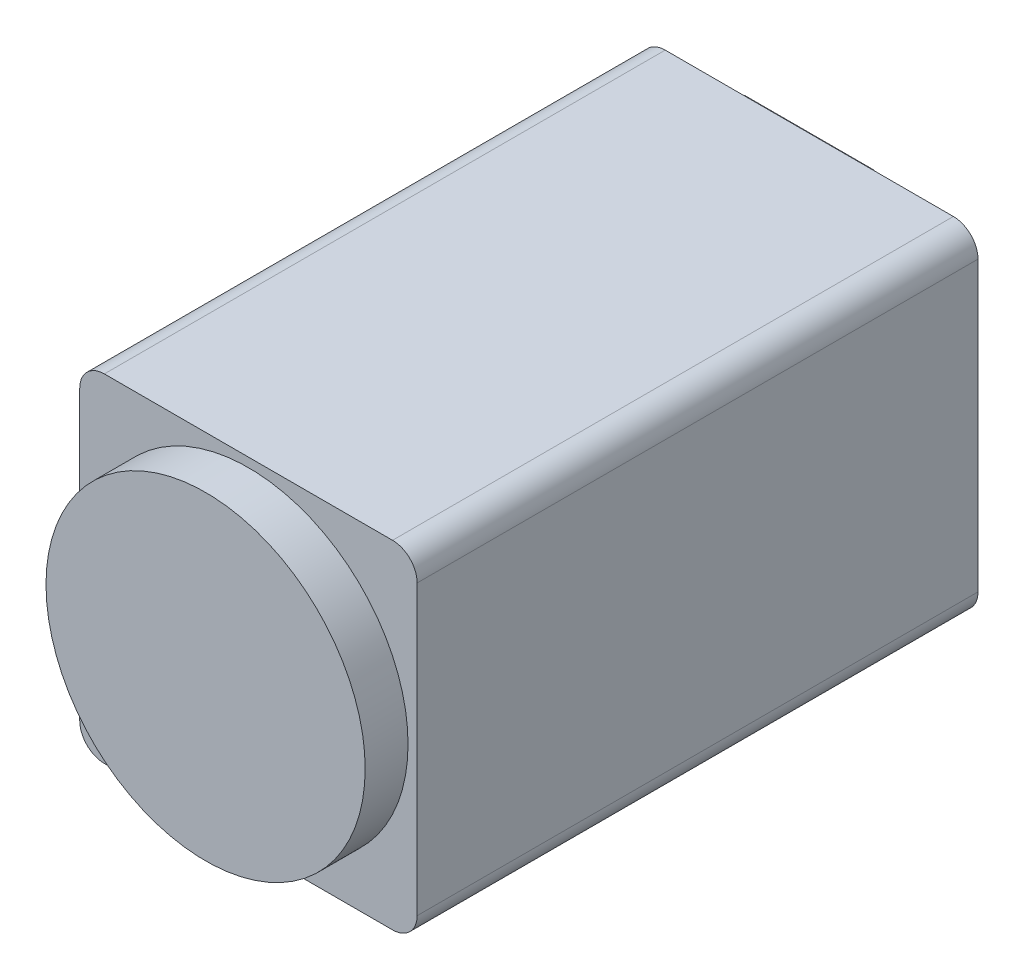
from build123d import *

# Parameters (mm, degrees)
BOSS_EXTRUDE1_DEPTH = 61.5
SKETCH3_R           = 17.5
BOSS_EXTRUDE2_DEPTH = 4.7
SKETCH4_W           = 14.228114438
SKETCH4_H           = 15.553065114
BOSS_EXTRUDE3_DEPTH = 6.3


with BuildPart() as part:
    # Sketch1 → Boss-Extrude1 (new body)
    with BuildSketch(Plane.XY):
        with BuildLine():
            Line((2.7, 0), (34.3, 0))
            ThreePointArc((34.3, 0), (36.209188309, 0.790811691), (37, 2.7))
            Line((37, 2.7), (37, 34.3))
            ThreePointArc((37, 34.3), (36.209188309, 36.209188309), (34.3, 37))
            Line((34.3, 37), (2.7, 37))
            ThreePointArc((2.7, 37), (0.790811691, 36.209188309), (0, 34.3))
            Line((0, 34.3), (0, 2.7))
            ThreePointArc((0, 2.7), (0.790811691, 0.790811691), (2.7, 0))
        make_face()
    extrude(amount=BOSS_EXTRUDE1_DEPTH)

    # Sketch3 → Boss-Extrude2 (add)
    with BuildSketch(Plane.XY.offset(61.5)):
        with Locations((18.5, 18.5)):
            Circle(SKETCH3_R)
    extrude(amount=BOSS_EXTRUDE2_DEPTH)

    # Sketch4 → Boss-Extrude3 (add)
    with BuildSketch(Plane(origin=(0, 0, 0), x_dir=(-1, 0, 0), z_dir=(0, 0, -1))):
        with Locations((-12.194929465, 22.979733571)):
            Rectangle(SKETCH4_W, SKETCH4_H)
    extrude(amount=BOSS_EXTRUDE3_DEPTH)


solid = part.part
